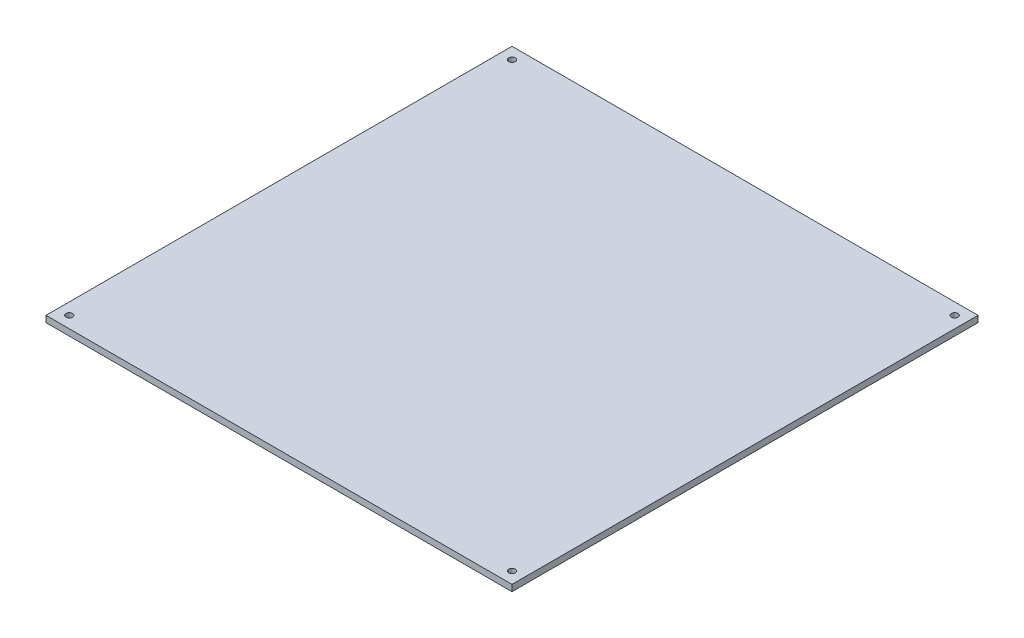
from build123d import *

# Parameters (mm, degrees)
SKETCH1_W           = 220
SKETCH1_H           = 220
SKETCH1_R           = 1.55
BOSS_EXTRUDE1_DEPTH = 3


with BuildPart() as part:
    # Sketch1 → Boss-Extrude1 (new body)
    with BuildSketch(Plane(origin=(0, 0, 0), x_dir=(1, 0, 0), z_dir=(0, 1, 0))):
        with Locations((110, 110)):
            Rectangle(SKETCH1_W, SKETCH1_H)
        with Locations(Location((5.5, 214.5, 0), (0, 0, 270))):
            Circle(SKETCH1_R, mode=Mode.SUBTRACT)
        with Locations(Location((5.5, 5.5, 0), (0, 0, 270))):
            Circle(SKETCH1_R, mode=Mode.SUBTRACT)
        with Locations(Location((214.5, 5.5, 0), (0, 0, 270))):
            Circle(SKETCH1_R, mode=Mode.SUBTRACT)
        with Locations(Location((214.5, 214.5, 0), (0, 0, 270))):
            Circle(SKETCH1_R, mode=Mode.SUBTRACT)
    extrude(amount=BOSS_EXTRUDE1_DEPTH)


solid = part.part
